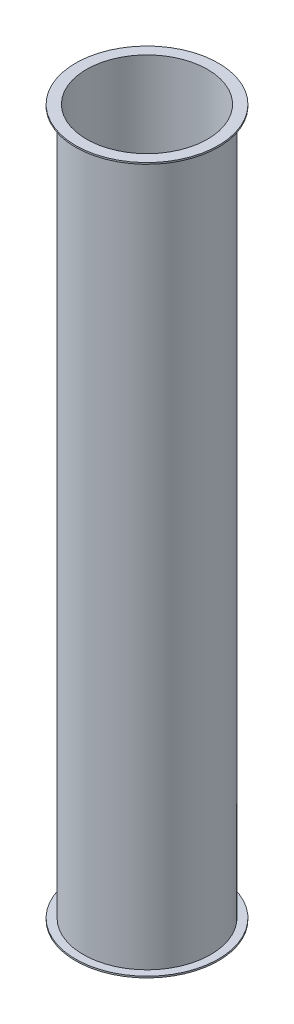
from build123d import *

# Parameters (mm, degrees)
SCHIZZO1_R                   = 41
SCHIZZO1_R_2                 = 39
ESTRUSIONE_SOTTILE1_DEPTH    = 227.5
SCHIZZO2_R                   = 46
SCHIZZO2_R_2                 = 41
ESTRUSIONE_ESTRUSIONE1_DEPTH = 1
ESTRUSIONE_ESTRUSIONE2_START = -1
SCHIZZO3_R                   = 46
SCHIZZO3_R_2                 = 41
ESTRUSIONE_ESTRUSIONE2_DEPTH = 1


with BuildPart() as part:
    # Schizzo1 → Estrusione-Sottile1 (new, symmetric)
    with BuildSketch(Plane(origin=(0, 0, 0), x_dir=(1, 0, 0), z_dir=(0, 1, 0))):
        Circle(SCHIZZO1_R)
        Circle(SCHIZZO1_R_2, mode=Mode.SUBTRACT)
    extrude(amount=ESTRUSIONE_SOTTILE1_DEPTH, both=True)

    # Schizzo2 → Estrusione-Estrusione1 (add)
    with BuildSketch(Plane(origin=(0, 227.5, 0), x_dir=(1, 0, 0), z_dir=(0, 1, 0))):
        with Locations(Location((0, 0, 0), (0, 0, 270))):
            Circle(SCHIZZO2_R)
        with Locations(Location((0, 0, 0), (0, 0, 90))):
            Circle(SCHIZZO2_R_2, mode=Mode.SUBTRACT)
    extrude(amount=-ESTRUSIONE_ESTRUSIONE1_DEPTH)

    # Schizzo3 → Estrusione-Estrusione2 (add)
    with BuildSketch(Plane.XZ.offset(227.5).offset(ESTRUSIONE_ESTRUSIONE2_START)):
        with Locations(Location((0, 0, 0), (0, 0, 90))):
            Circle(SCHIZZO3_R)
        with Locations(Location((0, 0, 0), (0, 0, 270))):
            Circle(SCHIZZO3_R_2, mode=Mode.SUBTRACT)
    extrude(amount=ESTRUSIONE_ESTRUSIONE2_DEPTH)


solid = part.part
